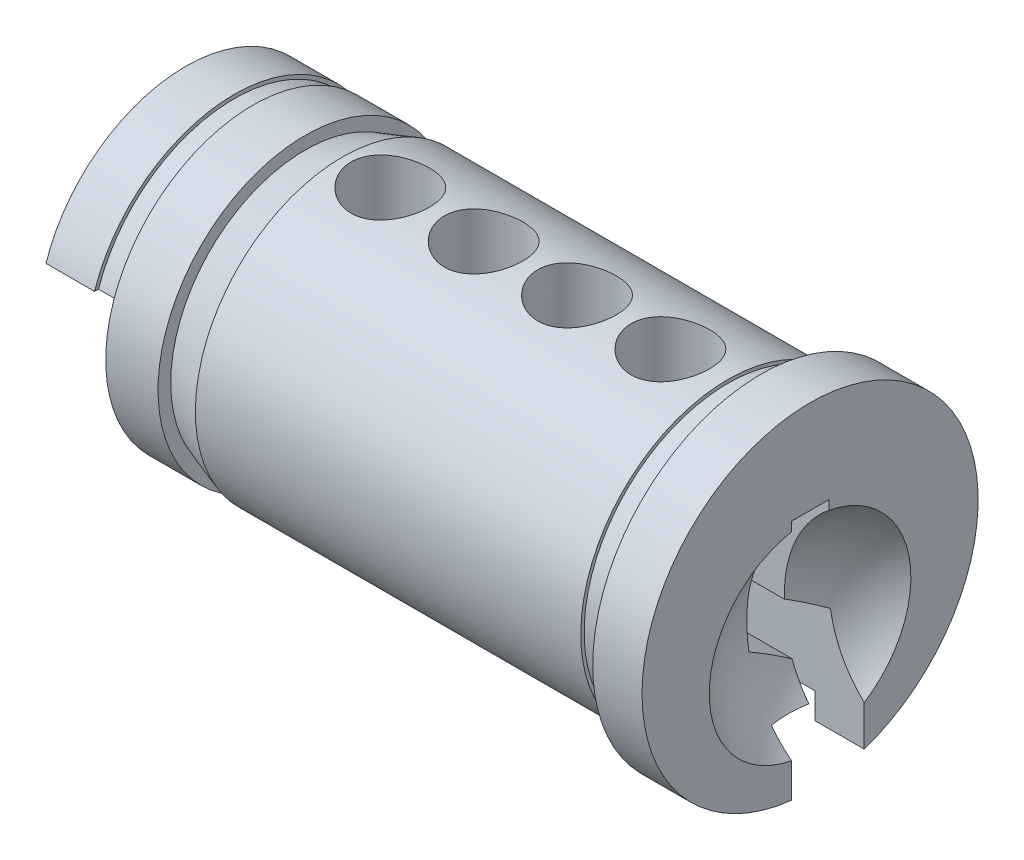
from build123d import *

# Parameters (mm, degrees)
SKETCH2_R           = 5.715
BOSS_EXTRUDE1_DEPTH = 18.9484
BOSS_EXTRUDE2_START = 2.286
BOSS_EXTRUDE2_DEPTH = 2.286
SKETCH6_W           = 0.635
SKETCH6_H           = 0.127
CUT_EXTRUDE2_DEPTH  = 1.778
CUT_EXTRUDE3_DEPTH  = 23.720523615
SKETCH12_R          = 1.3335
CUT_EXTRUDE4_DEPTH  = 6.096


with BuildPart() as part:
    # Sketch2 → Boss-Extrude1 (new body)
    with BuildSketch(Plane(origin=(0, 0, 0), x_dir=(0, 0, -1), z_dir=(1, 0, 0))):
        Circle(SKETCH2_R)
    extrude(amount=-BOSS_EXTRUDE1_DEPTH)

    # Sketch3 → Cut-Revolve1 (revolve, cut)
    with BuildSketch(Plane.XY, mode=Mode.PRIVATE) as cut_revolve1_sk:
        Polygon((-18.9484, 5.715), (-1.6764, 5.715), (-1.6764, 4.8895), (-2.794, 4.8895), (-2.794, 5.0038), (-15.9004, 5.0038), (-17.1704, 4.572), (-17.1704, 5.0038), (-18.9484, 5.0038), align=None)
    revolve(cut_revolve1_sk.sketch.rotate(Axis((0, 0, 0), (-1, 0, 0)), 90), axis=Axis((0, 0, 0), (-1, 0, 0)), mode=Mode.SUBTRACT)

    # Sketch5 → Boss-Extrude2 (add)
    with BuildSketch(Plane.ZY.offset(18.9484).offset(BOSS_EXTRUDE2_START)):
        with BuildLine():
            Line((-4.749528334, 1.5748), (4.749528334, 1.5748))
            ThreePointArc((4.749528334, 1.5748), (0, 5.0038), (-4.749528334, 1.5748))
        make_face()
    extrude(amount=-BOSS_EXTRUDE2_DEPTH)

    # Sketch6 → Cut-Revolve2 (revolve, cut)
    with BuildSketch(Plane.XY):
        with Locations((-19.2659, 4.9403)):
            Rectangle(SKETCH6_W, SKETCH6_H)
    revolve(axis=Axis((0, 0, 0), (1, 0, 0)), mode=Mode.SUBTRACT)

    # Sketch7 → Cut-Extrude2 (cut)
    with BuildSketch(Plane.ZY.offset(18.9484)):
        with BuildLine():
            Line((-2.484530314, -4.3434), (2.484530314, -4.3434))
            ThreePointArc((2.484530314, -4.3434), (0, -5.0038), (-2.484530314, -4.3434))
        make_face()
    extrude(amount=-CUT_EXTRUDE2_DEPTH, mode=Mode.SUBTRACT)

    # Sketch8 → Cut-Extrude3 (cut, through all)
    with BuildSketch(Plane(origin=(0, 0, 0), x_dir=(0, 0, -1), z_dir=(1, 0, 0))):
        Polygon((-0.635, -5.715), (1.8415, -5.715), (1.8415, -1.8395731), (0.635, -1.143), (0.635, 2.54), (-0.635, 2.54), (-0.635, -2.032), (0.635, -2.765234842), (0.635, -3.81), (-0.635, -3.81), align=None)
    extrude(amount=-CUT_EXTRUDE3_DEPTH, mode=Mode.SUBTRACT)

    # Sketch12 → Cut-Extrude4 (cut)
    with BuildSketch(Plane(origin=(0, 5.08, 0), x_dir=(1, 0, 0), z_dir=(0, 1, 0))):
        with Locations(Location((-4.7498, 0, 0), (0, 0, 270))):
            Circle(SKETCH12_R)
        with Locations(Location((-7.9248, 0, 0), (0, 0, 270))):
            Circle(SKETCH12_R)
        with Locations(Location((-11.0998, 0, 0), (0, 0, 270))):
            Circle(SKETCH12_R)
        with Locations(Location((-14.2748, 0, 0), (0, 0, 270))):
            Circle(SKETCH12_R)
    extrude(amount=-CUT_EXTRUDE4_DEPTH, mode=Mode.SUBTRACT)

    # Sketch13 → Cut-Revolve3 (revolve, cut)
    with BuildSketch(Plane.XY):
        with BuildLine():
            Line((0, 2.286), (0, -1.143))
            Line((0, -1.143), (-1.524, -1.143))
            ThreePointArc((-1.524, -1.143), (-1.180835312, 0.757649028), (0, 2.286))
        make_face()
    revolve(axis=Axis((-1.524, -1.143, 0), (1, 0, 0)), mode=Mode.SUBTRACT)


solid = part.part
